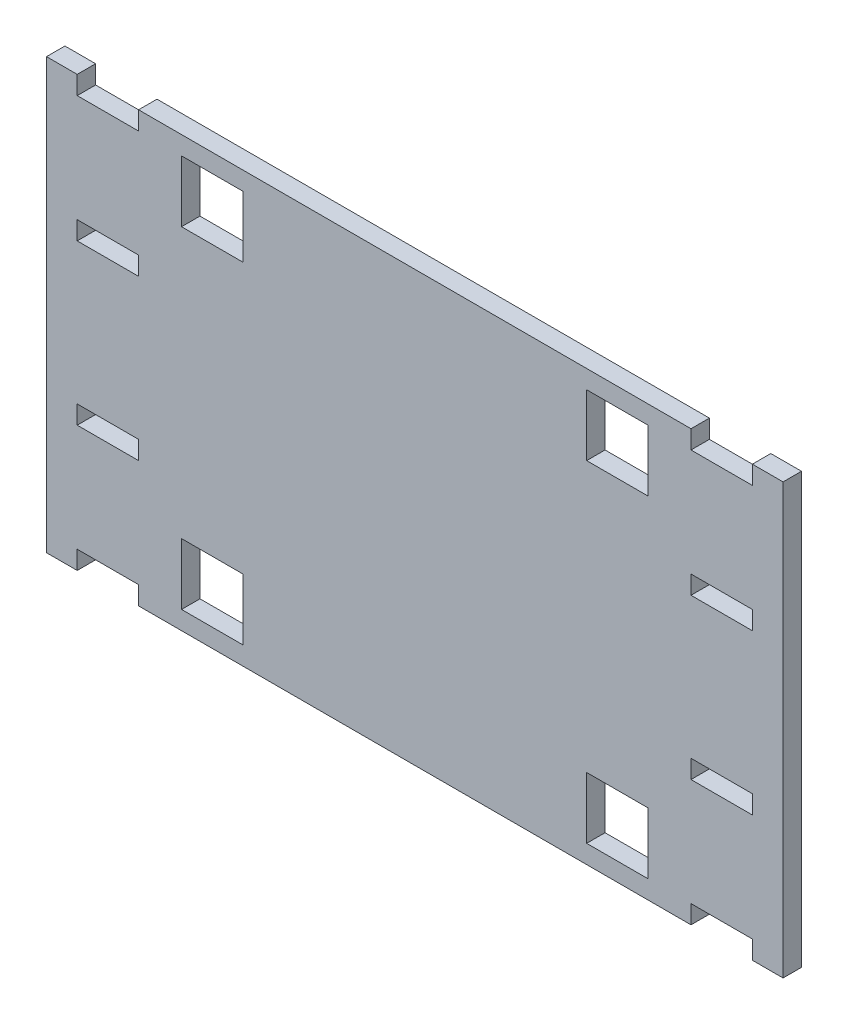
from build123d import *

# Parameters (mm, degrees)
SKETCH2_W               = 120
SKETCH2_H               = 70
BOSS_EXTRUDE1_DEPTH     = 3
SKETCH3_W               = 10
SKETCH3_H               = 3
CUT_EXTRUDE1_DEPTH      = 70.526973183
LPATTERN1_COUNT         = 2
LPATTERN1_PITCH         = 20.5
SKETCH4_W               = 10
SKETCH4_H               = 10
CUT_EXTRUDE2_DEPTH      = 70.526973183
MIRROR1_COPY_1_SKETCH_W = 10
MIRROR1_COPY_1_SKETCH_H = 3
MIRROR1_COPY_1_DEPTH    = 70.526973183
MIRROR2_COPY_1_SKETCH_W = 10
MIRROR2_COPY_1_SKETCH_H = 3
MIRROR2_COPY_1_DEPTH    = 70.526973183
MIRROR2_COPY_2_SKETCH_W = 10
MIRROR2_COPY_2_SKETCH_H = 3
MIRROR2_COPY_2_DEPTH    = 70.526973183
MIRROR2_COPY_3_SKETCH_W = 10
MIRROR2_COPY_3_SKETCH_H = 10
MIRROR2_COPY_3_DEPTH    = 70.526973183
MIRROR2_COPY_4_SKETCH_W = 10
MIRROR2_COPY_4_SKETCH_H = 3
MIRROR2_COPY_4_DEPTH    = 70.526973183


with BuildPart() as part:
    # Sketch2 → Boss-Extrude1 (new body)
    with BuildSketch(Plane.XY):
        Rectangle(SKETCH2_W, SKETCH2_H)
    extrude(amount=BOSS_EXTRUDE1_DEPTH)

    # Sketch3 → Cut-Extrude1 (cut, symmetric)
    with BuildSketch(Plane(origin=(0, 0, 0), x_dir=(-1, 0, 0), z_dir=(0, 0, -1))):
        with Locations((-50, 33.5)):
            Rectangle(SKETCH3_W, SKETCH3_H)
    cut_extrude1 = extrude(amount=CUT_EXTRUDE1_DEPTH, both=True, mode=Mode.SUBTRACT)

    # LPattern1: Cut-Extrude1 ×2
    with Locations(*[(0, -i * LPATTERN1_PITCH, 0) for i in range(1, LPATTERN1_COUNT)]):
        add(cut_extrude1, mode=Mode.SUBTRACT)

    # Sketch4 → Cut-Extrude2 (cut, through all)
    with BuildSketch(Plane(origin=(0, 0, 0), x_dir=(-1, 0, 0), z_dir=(0, 0, -1))):
        with Locations((-33, 27)):
            Rectangle(SKETCH4_W, SKETCH4_H)
    cut_extrude2 = extrude(amount=-CUT_EXTRUDE2_DEPTH, mode=Mode.SUBTRACT)

    # Mirror1: Cut-Extrude1, Cut-Extrude2 across plane
    add(cut_extrude1.mirror(Plane.ZX), mode=Mode.SUBTRACT)
    add(cut_extrude2.mirror(Plane.ZX), mode=Mode.SUBTRACT)

    # Mirror1 copy 1 sketch → Mirror1 copy 1 (cut, symmetric)
    with BuildSketch(Plane(origin=(0, 20.5, 0), x_dir=(-1, 0, 0), z_dir=(0, 0, -1))):
        with Locations((-50, -33.5)):
            Rectangle(MIRROR1_COPY_1_SKETCH_W, MIRROR1_COPY_1_SKETCH_H)
    extrude(amount=MIRROR1_COPY_1_DEPTH, both=True, mode=Mode.SUBTRACT)

    # Mirror2: Cut-Extrude1, Cut-Extrude2 across plane
    add(cut_extrude1.mirror(Plane(origin=(0, 0, 0), x_dir=(0, 0, 1), z_dir=(1, 0, 0))), mode=Mode.SUBTRACT)
    add(cut_extrude2.mirror(Plane(origin=(0, 0, 0), x_dir=(0, 0, 1), z_dir=(1, 0, 0))), mode=Mode.SUBTRACT)

    # Mirror2 copy 1 sketch → Mirror2 copy 1 (cut, symmetric)
    with BuildSketch(Plane(origin=(0, -20.5, 0), x_dir=(1, 0, 0), z_dir=(0, 0, -1))):
        with Locations((-50, -33.5)):
            Rectangle(MIRROR2_COPY_1_SKETCH_W, MIRROR2_COPY_1_SKETCH_H)
    extrude(amount=MIRROR2_COPY_1_DEPTH, both=True, mode=Mode.SUBTRACT)

    # Mirror2 copy 2 sketch → Mirror2 copy 2 (cut, symmetric)
    with BuildSketch(Plane(origin=(0, 0, 0), x_dir=(1, 0, 0), z_dir=(0, 0, -1))):
        with Locations((-50, 33.5)):
            Rectangle(MIRROR2_COPY_2_SKETCH_W, MIRROR2_COPY_2_SKETCH_H)
    extrude(amount=MIRROR2_COPY_2_DEPTH, both=True, mode=Mode.SUBTRACT)

    # Mirror2 copy 3 sketch → Mirror2 copy 3 (cut, through all)
    with BuildSketch(Plane(origin=(0, 0, 0), x_dir=(1, 0, 0), z_dir=(0, 0, -1))):
        with Locations((-33, 27)):
            Rectangle(MIRROR2_COPY_3_SKETCH_W, MIRROR2_COPY_3_SKETCH_H)
    extrude(amount=-MIRROR2_COPY_3_DEPTH, mode=Mode.SUBTRACT)

    # Mirror2 copy 4 sketch → Mirror2 copy 4 (cut, symmetric)
    with BuildSketch(Plane(origin=(0, 20.5, 0), x_dir=(1, 0, 0), z_dir=(0, 0, -1))):
        with Locations((-50, 33.5)):
            Rectangle(MIRROR2_COPY_4_SKETCH_W, MIRROR2_COPY_4_SKETCH_H)
    extrude(amount=MIRROR2_COPY_4_DEPTH, both=True, mode=Mode.SUBTRACT)


solid = part.part
